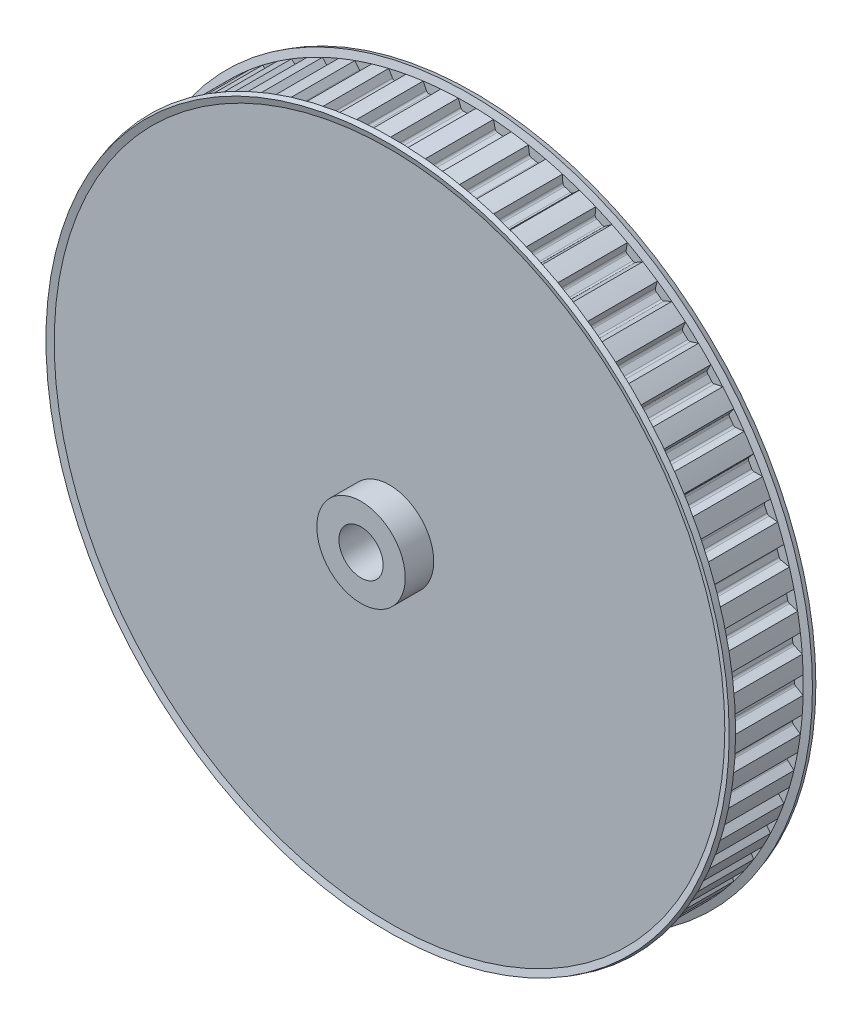
from build123d import *

# Parameters (mm, degrees)
SKETCH1_R        = 48.26
BASEPULLEY_DEPTH = 10.414
GROOVE_DEPTH     = 5.207
GROOVES_COUNT    = 60
GROOVES_ANGLE    = 354
SKETCH4_W        = 4.826
SKETCH4_H        = 6.35
BORSKE_R         = 3.175
BORE_DEPTH       = 72.557491307


with BuildPart() as part:
    # Sketch1 → BasePulley (new body)
    with BuildSketch(Plane.XY):
        Circle(SKETCH1_R)
    extrude(amount=-BASEPULLEY_DEPTH)

    # Sketch2 → Flange (revolve)
    with BuildSketch(Plane(origin=(0, 0, 0), x_dir=(0, 0, -1), z_dir=(1, 0, 0)), mode=Mode.PRIVATE) as flange_sk:
        Polygon((10.414, 48.26), (10.724622372, 49.276), (11.429036456, 49.060639002), (11.1506, 48.149914392), (11.1506, 0), (-0.7366, 0), (-0.7366, 48.149914392), (-1.015036456, 49.060639002), (-0.310622372, 49.276), (0, 48.26), align=None)
    revolve(flange_sk.sketch.rotate(Axis((0, 0, 0), (0, 0, -1)), 90), axis=Axis((0, 0, 0), (0, 0, -1)))

    # Sketch3 → Groove (cut, symmetric)
    with BuildSketch(Plane.XY.offset(-5.207)):
        with BuildLine():
            Line((-1.2827, 48.26), (-1.2827, 73.66))
            Line((-1.2827, 73.66), (1.2827, 73.66))
            Line((1.2827, 73.66), (1.2827, 48.26))
            Line((1.2827, 48.26), (0.659450384, 47.1805))
            ThreePointArc((0.659450384, 47.1805), (0.519994706, 47.041044321), (0.329494706, 46.99))
            Line((0.329494706, 46.99), (-0.55367873, 46.99))
            ThreePointArc((-0.55367873, 46.99), (-0.772211353, 47.058903071), (-0.911701619, 47.240690325))
            Line((-0.911701619, 47.240690325), (-1.2827, 48.26))
        make_face()
    groove = extrude(amount=GROOVE_DEPTH, both=True, mode=Mode.SUBTRACT)

    # Grooves: Groove ×60 about axis
    grooves_axis = Axis((0, 0, -10.414), (0, 0, 1))
    for i in range(1, GROOVES_COUNT):
        add(groove.rotate(grooves_axis, i * GROOVES_ANGLE / (GROOVES_COUNT - 1)), mode=Mode.SUBTRACT)

    # Sketch4 → BaseHub (revolve)
    with BuildSketch(Plane(origin=(0, 0, 0), x_dir=(0, 0, -1), z_dir=(1, 0, 0)), mode=Mode.PRIVATE) as basehub_sk:
        with Locations((-2.413, 3.175)):
            Rectangle(SKETCH4_W, SKETCH4_H)
    revolve(basehub_sk.sketch.rotate(Axis((0, 0, 0), (0, 0, -1)), 271.511526361), axis=Axis((0, 0, 0), (0, 0, -1)))

    # BorSke → Bore (cut, through all)
    with BuildSketch(Plane.XY.offset(4.826)):
        Circle(BORSKE_R)
    extrude(amount=-BORE_DEPTH, mode=Mode.SUBTRACT)


solid = part.part
